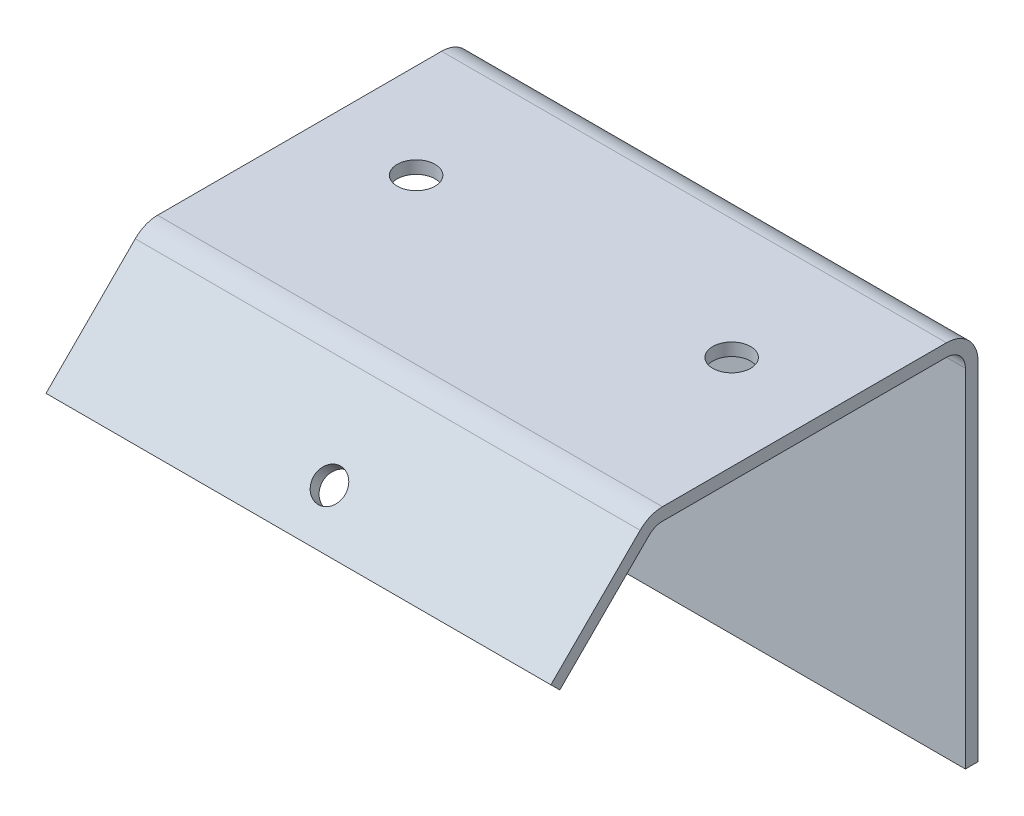
from build123d import *

# Parameters (mm, degrees)
EXTRUDE_3_DEPTH     = 80
SKETCH_13_R         = 4
CUT_EXTRUDE_2_DEPTH = 99.895253058
SWEEP_8_PROFILE_R   = 3
SWEEP_10_PROFILE_R  = 3
SWEEP_12_PROFILE_R  = 2.5


with BuildPart() as part:
    # 草图12 → 凸台-拉伸3 (new body)
    with BuildSketch(Plane(origin=(-40, 0, 0), x_dir=(0, 0, -1), z_dir=(1, 0, 0))):
        with BuildLine():
            Line((0, 0), (0, 55))
            ThreePointArc((0, 55), (-1.4645, 58.5355), (-5, 60))
            Line((-5, 60), (-50, 60))
            ThreePointArc((-50, 60), (-51.913411069, 59.619395415), (-53.5355, 58.5355))
            Line((-53.5355, 58.5355), (-67.6777, 44.3934))
            Line((-67.6777, 44.3934), (-66.2634, 42.9792))
            Line((-66.2634, 42.9792), (-52.1213, 57.1213))
            ThreePointArc((-52.1213, 57.1213), (-51.148041287, 57.771624321), (-50, 58))
            Line((-50, 58), (-5, 58))
            ThreePointArc((-5, 58), (-2.8787, 57.1213), (-2, 55))
            Line((-2, 55), (-2, 0))
            Line((-2, 0), (0, 0))
        make_face()
    extrude(amount=EXTRUDE_3_DEPTH)

    # 草图13 → 切除-拉伸2 (cut, through all)
    with BuildSketch(Plane.XY):
        with Locations(Location((0, 25, 0), (0, 0, 180))):
            Circle(SKETCH_13_R)
    extrude(amount=CUT_EXTRUDE_2_DEPTH, mode=Mode.SUBTRACT)

    # 切除-扫描8: sweep along a curve in space
    with BuildLine() as sweep_8_path:
        Line((-25, 53.8, 24.031), (-25, 63.8, 24.031))
    # 切除-扫描8 profile (on start of the path) → 切除-扫描8 (sweep, cut)
    with BuildSketch(Plane(origin=(-25, 53.8, 24.031), x_dir=(0, 0, 1), z_dir=(0, 1, 0))):
        Circle(SWEEP_8_PROFILE_R)
    sweep(path=sweep_8_path.line, mode=Mode.SUBTRACT)

    # 切除-扫描10: sweep along a curve in space
    with BuildLine() as sweep_10_path:
        Line((25, 53.8, 24.031), (25, 63.8, 24.031))
    # 切除-扫描10 profile (on start of the path) → 切除-扫描10 (sweep, cut)
    with BuildSketch(Plane(origin=(25, 53.8, 24.031), x_dir=(0, 0, 1), z_dir=(0, 1, 0))):
        Circle(SWEEP_10_PROFILE_R)
    sweep(path=sweep_10_path.line, mode=Mode.SUBTRACT)

    # 切除-扫描12: sweep along a curve in space
    with BuildLine() as sweep_12_path:
        Line((0, 44.926466, 58.376466), (0, 51.997534, 65.447534))
    # 切除-扫描12 profile (on start of the path) → 切除-扫描12 (sweep, cut)
    with BuildSketch(Plane(origin=(0, 44.926466, 58.376466), x_dir=(0, 0.7071067811865476, -0.7071067811865476), z_dir=(0, 0.7071067811865476, 0.7071067811865476))):
        Circle(SWEEP_12_PROFILE_R)
    sweep(path=sweep_12_path.line, mode=Mode.SUBTRACT)


solid = part.part
